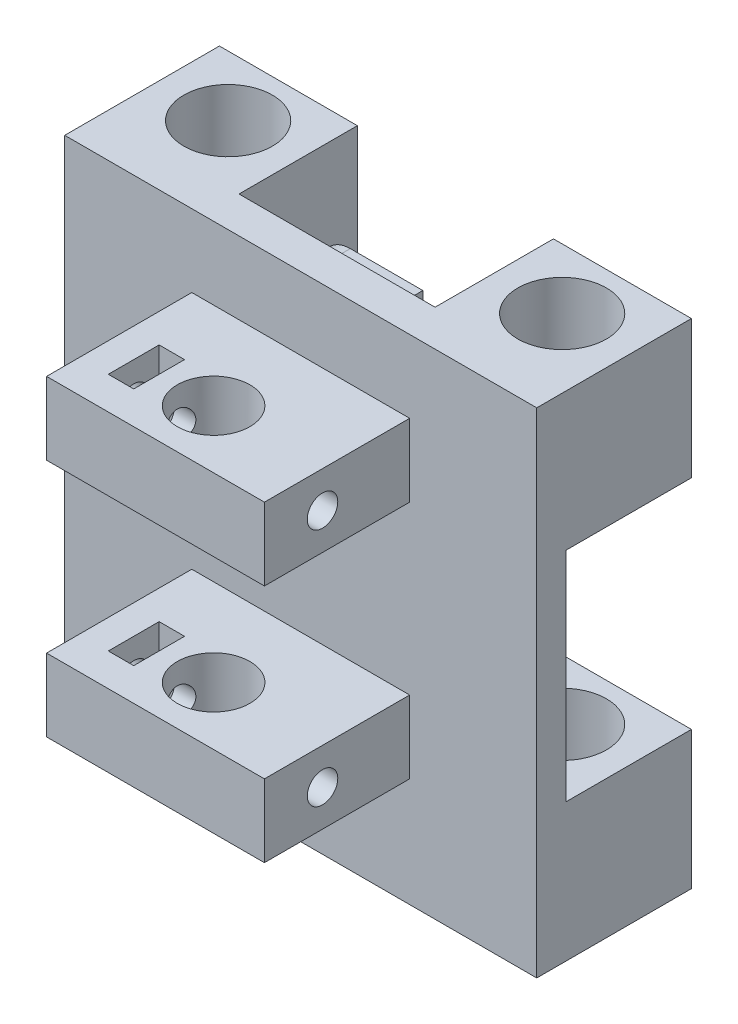
from build123d import *

# Parameters (mm, degrees)
SKETCH1_W           = 19
SKETCH1_H           = 17
SKETCH1_R           = 6.1
BOSS_EXTRUDE1_DEPTH = 68
CUT_EXTRUDE1_REACH  = 80.513
SKETCH3_W           = 65
SKETCH3_H           = 30
SKETCH4_W           = 5
SKETCH4_H           = 4
BOSS_EXTRUDE2_DEPTH = 3
SKETCH5_W           = 30
SKETCH5_H           = 10
BOSS_EXTRUDE3_DEPTH = 20
SKETCH6_R           = 5
CUT_EXTRUDE2_DEPTH  = 75.224322159
SKETCH8_R           = 2.1
CUT_EXTRUDE3_DEPTH  = 90.270655873
CUT_EXTRUDE4_REACH  = 72.386
SKETCH9_W           = 3.5
SKETCH9_H           = 3.5
SKETCH10_W          = 19
SKETCH10_H          = 19
CUT_EXTRUDE5_DEPTH  = 0.7
SKETCH11_W          = 65
SKETCH11_H          = 30
CUT_EXTRUDE6_DEPTH  = 1


with BuildPart() as part:
    # Sketch1 → Boss-Extrude1 (new body)
    # profile 1 of 3: a face of its own
    with BuildSketch(Plane(origin=(0, 0, 0), x_dir=(1, 0, 0), z_dir=(0, 1, 0))):
        with Locations((-23, 0.5)):
            Rectangle(SKETCH1_W, SKETCH1_H)
        with Locations(Location((-23, 0, 0), (0, 0, 270))):
            Circle(SKETCH1_R, mode=Mode.SUBTRACT)
    # profile 2 of 3: a face of its own
    with BuildSketch(Plane(origin=(0, 0, 0), x_dir=(1, 0, 0), z_dir=(0, 1, 0))):
        with Locations((23, 0.5)):
            Rectangle(SKETCH1_W, SKETCH1_H)
        with Locations(Location((23, 0, 0), (0, 0, 270))):
            Circle(SKETCH1_R, mode=Mode.SUBTRACT)
    # profile 3 of 3: a face of its own
    with BuildSketch(Plane(origin=(0, 0, 0), x_dir=(1, 0, 0), z_dir=(0, 1, 0))):
        Polygon((-13.5, -8), (13.5, -8), (32.5, -8), (32.5, -13), (-32.5, -13), (-32.5, -8), align=None)
    extrude(amount=BOSS_EXTRUDE1_DEPTH)

    # Cut-Extrude1: up to this face of the body (flat: up to its plane)
    cut_extrude1_end = Plane(part.part.faces().sort_by_distance((0, 34, 8))[0])
    # Sketch3 → Cut-Extrude1 (cut, up to the picked face)
    with BuildSketch(Plane(origin=(0, 0, -9), x_dir=(-1, 0, 0), z_dir=(0, 0, -1)), mode=Mode.PRIVATE) as cut_extrude1_sk1:
        with Locations((0, 34)):
            Rectangle(SKETCH3_W, SKETCH3_H)
    cut_extrude1_tool1 = split(extrude(cut_extrude1_sk1.sketch, amount=-CUT_EXTRUDE1_REACH, mode=Mode.PRIVATE), bisect_by=cut_extrude1_end, keep=Keep.BOTH, mode=Mode.PRIVATE)
    add(cut_extrude1_tool1.solids().sort_by(Axis((0, 34, -9), (0, 0, 1)))[0], mode=Mode.SUBTRACT)

    # Sketch4 → Boss-Extrude2 (add)
    with BuildSketch(Plane(origin=(0, 0, 8), x_dir=(-1, 0, 0), z_dir=(0, 0, -1))):
        with BuildLine():
            ThreePointArc((4.191236083, 59.518146972), (4.82097308, 63.804174702), (1.17903595, 66.15))
            Line((1.17903595, 66.15), (-8.82096405, 66.15))
            Line((-8.82096405, 66.15), (-8.82096405, 62.15))
            Line((-8.82096405, 62.15), (1.17903595, 62.15))
            ThreePointArc((1.17903595, 62.15), (3.230210626, 61.45792056), (4.191236083, 59.518146972))
        make_face()
        with Locations((-6.32096405, 56.15)):
            Rectangle(SKETCH4_W, SKETCH4_H)
    extrude(amount=BOSS_EXTRUDE2_DEPTH)

    # Sketch5 → Boss-Extrude3 (add)
    with BuildSketch(Plane.XY.offset(13)):
        with Locations((0, 20)):
            Rectangle(SKETCH5_W, SKETCH5_H)
        with Locations((0, 53)):
            Rectangle(SKETCH5_W, SKETCH5_H)
    extrude(amount=BOSS_EXTRUDE3_DEPTH)

    # Sketch6 → Cut-Extrude2 (cut, through all)
    with BuildSketch(Plane(origin=(0, 58, 0), x_dir=(1, 0, 0), z_dir=(0, 1, 0))):
        with Locations(Location((0, -25, 0), (0, 0, 270))):
            Circle(SKETCH6_R)
    extrude(amount=-CUT_EXTRUDE2_DEPTH, mode=Mode.SUBTRACT)

    # Sketch8 → Cut-Extrude3 (cut, through all)
    with BuildSketch(Plane.ZY.offset(15)):
        with Locations((25, 20)):
            Circle(SKETCH8_R)
        with Locations((25, 53)):
            Circle(SKETCH8_R)
    extrude(amount=-CUT_EXTRUDE3_DEPTH, mode=Mode.SUBTRACT)

    # Cut-Extrude4: up to this face of the body (flat: up to its plane)
    cut_extrude4_end = Plane(part.part.faces().sort_by_distance((14.639444872, 58, 23))[0])
    # Sketch9 → Cut-Extrude4 (cut, up to the picked face)
    with BuildSketch(Plane.XZ.offset(-15), mode=Mode.PRIVATE) as cut_extrude4_sk1:
        with Locations((-9.25, 23.25)):
            Rectangle(SKETCH9_W, SKETCH9_H)
    cut_extrude4_tool1 = split(extrude(cut_extrude4_sk1.sketch, amount=-CUT_EXTRUDE4_REACH, mode=Mode.PRIVATE), bisect_by=cut_extrude4_end, keep=Keep.BOTH, mode=Mode.PRIVATE)
    # Sketch9 → Cut-Extrude4 (cut, up to the picked face)
    with BuildSketch(Plane.XZ.offset(-15), mode=Mode.PRIVATE) as cut_extrude4_sk2:
        with Locations((-9.25, 26.75)):
            Rectangle(SKETCH9_W, SKETCH9_H)
    cut_extrude4_tool2 = split(extrude(cut_extrude4_sk2.sketch, amount=-CUT_EXTRUDE4_REACH, mode=Mode.PRIVATE), bisect_by=cut_extrude4_end, keep=Keep.BOTH, mode=Mode.PRIVATE)
    add(cut_extrude4_tool1.solids().sort_by(Axis((-9.25, 15, 23.25), (0, 1, 0)))[0], mode=Mode.SUBTRACT)
    add(cut_extrude4_tool2.solids().sort_by(Axis((-9.25, 15, 26.75), (0, 1, 0)))[0], mode=Mode.SUBTRACT)

    # Sketch10 → Cut-Extrude5 (cut)
    with BuildSketch(Plane(origin=(0, 0, -9), x_dir=(-1, 0, 0), z_dir=(0, 0, -1))):
        with Locations((23, 9.5)):
            Rectangle(SKETCH10_W, SKETCH10_H)
        with Locations((-23, 9.5)):
            Rectangle(SKETCH10_W, SKETCH10_H)
        with Locations((23, 58.5)):
            Rectangle(SKETCH10_W, SKETCH10_H)
        with Locations((-23, 58.5)):
            Rectangle(SKETCH10_W, SKETCH10_H)
    extrude(amount=-CUT_EXTRUDE5_DEPTH, mode=Mode.SUBTRACT)

    # Sketch11 → Cut-Extrude6 (cut)
    with BuildSketch(Plane(origin=(0, 0, 8), x_dir=(-1, 0, 0), z_dir=(0, 0, -1))):
        with Locations((0, 34)):
            Rectangle(SKETCH11_W, SKETCH11_H)
    extrude(amount=-CUT_EXTRUDE6_DEPTH, mode=Mode.SUBTRACT)


solid = part.part
